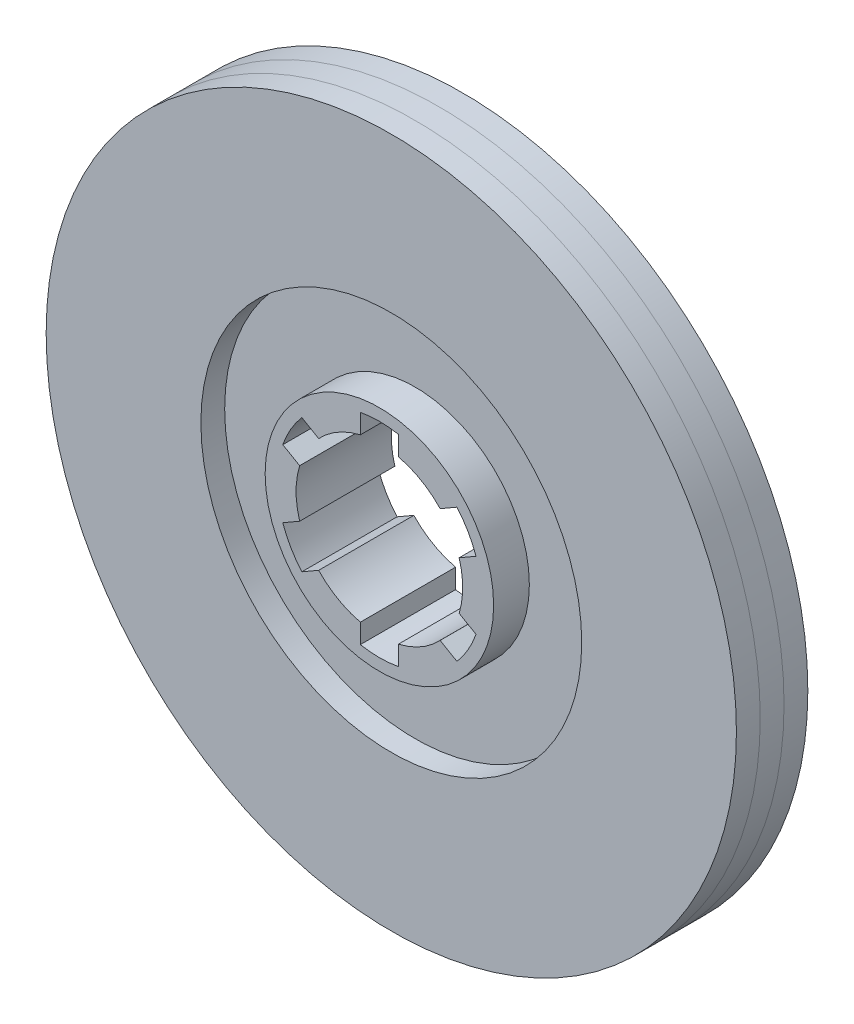
from build123d import *

# Parameters (mm, degrees)
SKETCH1_R           = 72.5
BOSS_EXTRUDE1_DEPTH = 2.5
SKETCH3_R           = 24
BOSS_EXTRUDE2_DEPTH = 10
SKETCH4_R           = 72.5
SKETCH4_R_2         = 40
BOSS_EXTRUDE3_DEPTH = 5
CUT_EXTRUDE1_DEPTH  = 105.462912079


with BuildPart() as part:
    # Sketch1 → Boss-Extrude1 (new, symmetric)
    with BuildSketch(Plane.XY):
        Circle(SKETCH1_R)
    extrude(amount=BOSS_EXTRUDE1_DEPTH, both=True)

    # Sketch3 → Boss-Extrude2 (add, symmetric)
    with BuildSketch(Plane.XY):
        Circle(SKETCH3_R)
    extrude(amount=BOSS_EXTRUDE2_DEPTH, both=True)

    # Sketch5 → Cut-Extrude1 (cut, through all)
    with BuildSketch(Plane.XY.offset(10)):
        with BuildLine():
            ThreePointArc((4, 21.124630174), (0, 21.5), (-4, 21.124630174))
            Line((-4, 21.124630174), (-4, 17.036725037))
            ThreePointArc((-4, 17.036725037), (-8.75, 15.155444566), (-12.75423668, 11.982464134))
            Line((-12.75423668, 11.982464134), (-16.294466376, 14.026416702))
            ThreePointArc((-16.294466376, 14.026416702), (-18.619546181, 10.75), (-20.294466376, 7.098213472))
            Line((-20.294466376, 7.098213472), (-16.75423668, 5.054260904))
            ThreePointArc((-16.75423668, 5.054260904), (-17.5, 0), (-16.75423668, -5.054260904))
            Line((-16.75423668, -5.054260904), (-20.294466376, -7.098213472))
            ThreePointArc((-20.294466376, -7.098213472), (-18.619546181, -10.75), (-16.294466376, -14.026416702))
            Line((-16.294466376, -14.026416702), (-12.75423668, -11.982464134))
            ThreePointArc((-12.75423668, -11.982464134), (-8.75, -15.155444566), (-4, -17.036725037))
            Line((-4, -17.036725037), (-4, -21.124630174))
            ThreePointArc((-4, -21.124630174), (0, -21.5), (4, -21.124630174))
            Line((4, -21.124630174), (4, -17.036725037))
            ThreePointArc((4, -17.036725037), (8.75, -15.155444566), (12.75423668, -11.982464134))
            Line((12.75423668, -11.982464134), (16.294466376, -14.026416702))
            ThreePointArc((16.294466376, -14.026416702), (18.619546181, -10.75), (20.294466376, -7.098213472))
            Line((20.294466376, -7.098213472), (16.75423668, -5.054260904))
            ThreePointArc((16.75423668, -5.054260904), (17.5, 0), (16.75423668, 5.054260904))
            Line((16.75423668, 5.054260904), (20.294466376, 7.098213472))
            ThreePointArc((20.294466376, 7.098213472), (18.619546181, 10.75), (16.294466376, 14.026416702))
            Line((16.294466376, 14.026416702), (12.75423668, 11.982464134))
            ThreePointArc((12.75423668, 11.982464134), (8.75, 15.155444566), (4, 17.036725037))
            Line((4, 17.036725037), (4, 21.124630174))
        make_face()
    extrude(amount=-CUT_EXTRUDE1_DEPTH, mode=Mode.SUBTRACT)


with BuildPart() as body_2:
    # Sketch4 → Boss-Extrude3 (new body)
    with BuildSketch(Plane.XY.offset(2.5)):
        Circle(SKETCH4_R)
        Circle(SKETCH4_R_2, mode=Mode.SUBTRACT)
    extrude(amount=BOSS_EXTRUDE3_DEPTH)


with BuildPart() as body_3:
    # Mirror3: mirrored copy
    add(body_2.part.mirror(Plane.XY))


solid = Compound([part.part, body_2.part, body_3.part])
